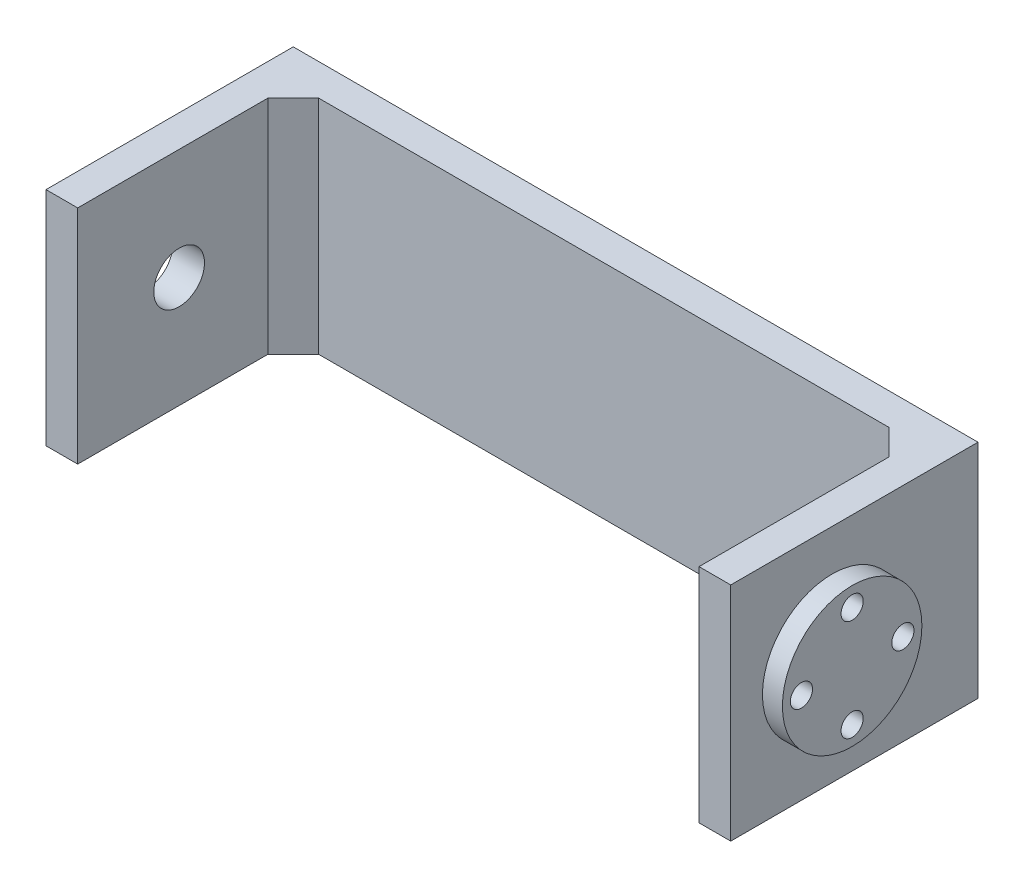
from build123d import *

# Parameters (mm, degrees)
BOSS_EXTRUDE2_DEPTH = 35
SKETCH3_R           = 11
SKETCH3_R_2         = 1.75
BOSS_EXTRUDE5_DEPTH = 3.15
CUT_EXTRUDE2_REACH  = 122.042
SKETCH5_R           = 1.75
SKETCH6_R           = 2.5
CUT_EXTRUDE3_DEPTH  = 2.15
CUT_EXTRUDE4_REACH  = 124.883
SKETCH7_R           = 4
CHAMFER1_SIZE       = 4


with BuildPart() as part:
    # Sketch1 → Boss-Extrude2 (new body)
    with BuildSketch(Plane(origin=(0, 0, 0), x_dir=(1, 0, 0), z_dir=(0, 1, 0))):
        Polygon((0, 0), (0, 39), (108, 39), (108, 0), (103, 0), (103, 34), (5, 34), (5, 0), align=None)
    extrude(amount=BOSS_EXTRUDE2_DEPTH)

    # Sketch3 → Boss-Extrude5 (add)
    with BuildSketch(Plane(origin=(108, 0, 0), x_dir=(0, 0, -1), z_dir=(1, 0, 0))):
        with Locations(Location((16, 17.5, 0), (0, 0, 180))):
            Circle(SKETCH3_R)
        with Locations((16, 9.5)):
            Circle(SKETCH3_R_2, mode=Mode.SUBTRACT)
        with Locations((8, 17.5)):
            Circle(SKETCH3_R_2, mode=Mode.SUBTRACT)
        with Locations((16, 25.5)):
            Circle(SKETCH3_R_2, mode=Mode.SUBTRACT)
        with Locations((24, 17.5)):
            Circle(SKETCH3_R_2, mode=Mode.SUBTRACT)
    extrude(amount=BOSS_EXTRUDE5_DEPTH)

    # Sketch5 → Cut-Extrude2 (cut, up to next)
    with BuildSketch(Plane(origin=(108, 0, 0), x_dir=(0, 0, -1), z_dir=(1, 0, 0)), mode=Mode.PRIVATE) as cut_extrude2_sk1:
        with Locations((16, 9.5)):
            Circle(SKETCH5_R)
    cut_extrude2_tool1 = extrude(cut_extrude2_sk1.sketch, amount=-CUT_EXTRUDE2_REACH, mode=Mode.PRIVATE) & part.part
    # Sketch5 → Cut-Extrude2 (cut, up to next)
    with BuildSketch(Plane(origin=(108, 0, 0), x_dir=(0, 0, -1), z_dir=(1, 0, 0)), mode=Mode.PRIVATE) as cut_extrude2_sk2:
        with Locations((24, 17.5)):
            Circle(SKETCH5_R)
    cut_extrude2_tool2 = extrude(cut_extrude2_sk2.sketch, amount=-CUT_EXTRUDE2_REACH, mode=Mode.PRIVATE) & part.part
    # Sketch5 → Cut-Extrude2 (cut, up to next)
    with BuildSketch(Plane(origin=(108, 0, 0), x_dir=(0, 0, -1), z_dir=(1, 0, 0)), mode=Mode.PRIVATE) as cut_extrude2_sk3:
        with Locations((16, 25.5)):
            Circle(SKETCH5_R)
    cut_extrude2_tool3 = extrude(cut_extrude2_sk3.sketch, amount=-CUT_EXTRUDE2_REACH, mode=Mode.PRIVATE) & part.part
    # Sketch5 → Cut-Extrude2 (cut, up to next)
    with BuildSketch(Plane(origin=(108, 0, 0), x_dir=(0, 0, -1), z_dir=(1, 0, 0)), mode=Mode.PRIVATE) as cut_extrude2_sk4:
        with Locations((8, 17.5)):
            Circle(SKETCH5_R)
    cut_extrude2_tool4 = extrude(cut_extrude2_sk4.sketch, amount=-CUT_EXTRUDE2_REACH, mode=Mode.PRIVATE) & part.part
    add(cut_extrude2_tool1.solids().sort_by_distance((108, 9.5, -16))[0], mode=Mode.SUBTRACT)
    add(cut_extrude2_tool2.solids().sort_by_distance((108, 17.5, -24))[0], mode=Mode.SUBTRACT)
    add(cut_extrude2_tool3.solids().sort_by_distance((108, 25.5, -16))[0], mode=Mode.SUBTRACT)
    add(cut_extrude2_tool4.solids().sort_by_distance((108, 17.5, -8))[0], mode=Mode.SUBTRACT)

    # Sketch6 → Cut-Extrude3 (cut)
    with BuildSketch(Plane.ZY.offset(-103)):
        with Locations((-16, 9.5)):
            Circle(SKETCH6_R)
        with Locations((-24, 17.5)):
            Circle(SKETCH6_R)
        with Locations((-16, 25.5)):
            Circle(SKETCH6_R)
        with Locations((-8, 17.5)):
            Circle(SKETCH6_R)
    extrude(amount=-CUT_EXTRUDE3_DEPTH, mode=Mode.SUBTRACT)

    # Sketch7 → Cut-Extrude4 (cut, up to next)
    with BuildSketch(Plane.ZY, mode=Mode.PRIVATE) as cut_extrude4_sk1:
        with Locations((-16, 17.5)):
            Circle(SKETCH7_R)
    cut_extrude4_tool1 = extrude(cut_extrude4_sk1.sketch, amount=-CUT_EXTRUDE4_REACH, mode=Mode.PRIVATE) & part.part
    add(cut_extrude4_tool1.solids().sort_by_distance((0, 17.5, -16))[0], mode=Mode.SUBTRACT)

    # Chamfer1
    chamfer1_edges = [part.edges().sort_by_distance(p)[0] for p in [
        (103, 17.5, -34),
        (5, 17.5, -34),
    ]]
    chamfer(chamfer1_edges, length=CHAMFER1_SIZE)


solid = part.part
